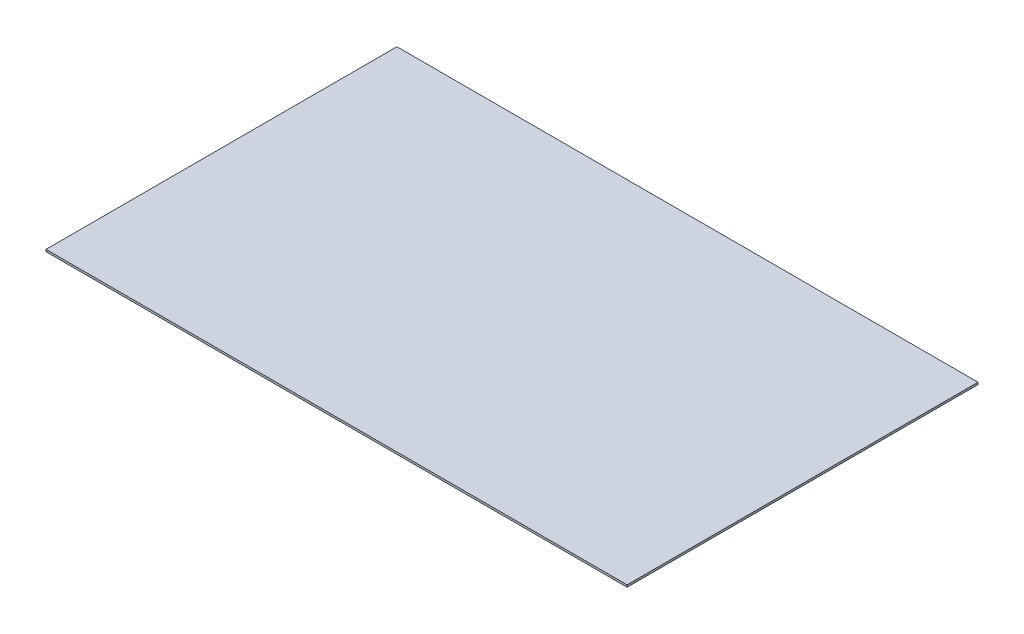
from build123d import *

# Parameters (mm, degrees)
SKETCH1_W           = 828
SKETCH1_H           = 500
BOSS_EXTRUDE1_DEPTH = 3


with BuildPart() as part:
    # Sketch1 → Boss-Extrude1 (new body)
    with BuildSketch(Plane(origin=(0, 0, 0), x_dir=(1, 0, 0), z_dir=(0, 1, 0))):
        with Locations((-414, -250)):
            Rectangle(SKETCH1_W, SKETCH1_H)
    extrude(amount=BOSS_EXTRUDE1_DEPTH)


solid = part.part
